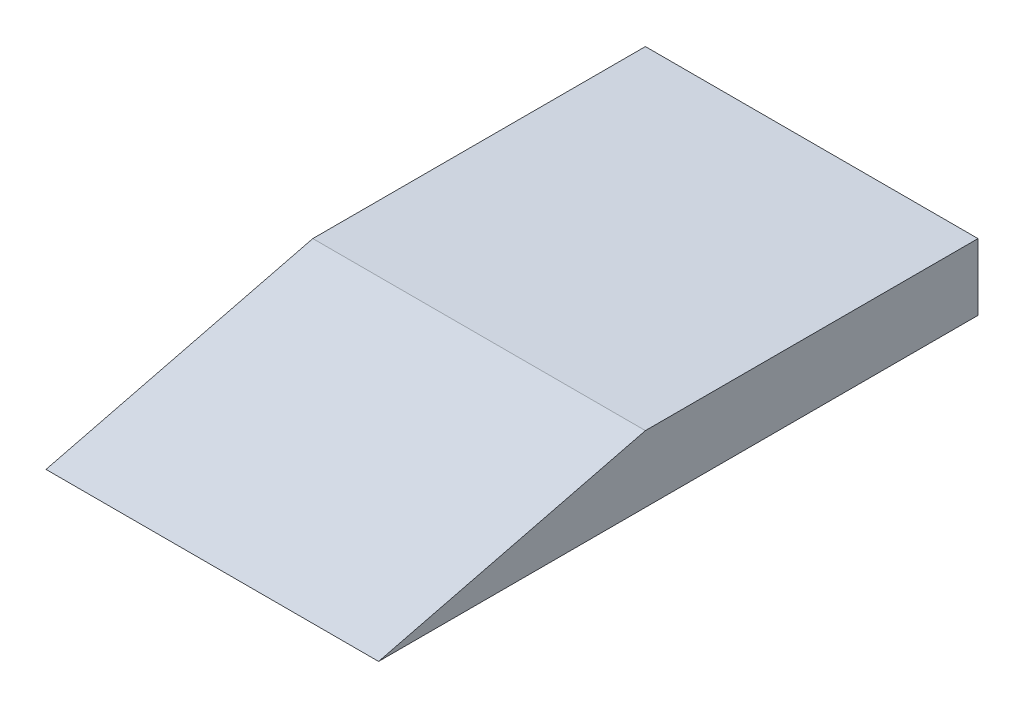
from build123d import *

# Parameters (mm, degrees)
EXTRUDE_1_DEPTH = 1000


with BuildPart() as part:
    # 草图1 → 凸台-拉伸1 (new body)
    with BuildSketch(Plane(origin=(0, 0, 0), x_dir=(0, 0, -1), z_dir=(1, 0, 0))):
        Polygon((0, 200), (-802.156186707, 0), (1000, 0), (1000, 200), align=None)
    extrude(amount=EXTRUDE_1_DEPTH)


solid = part.part
